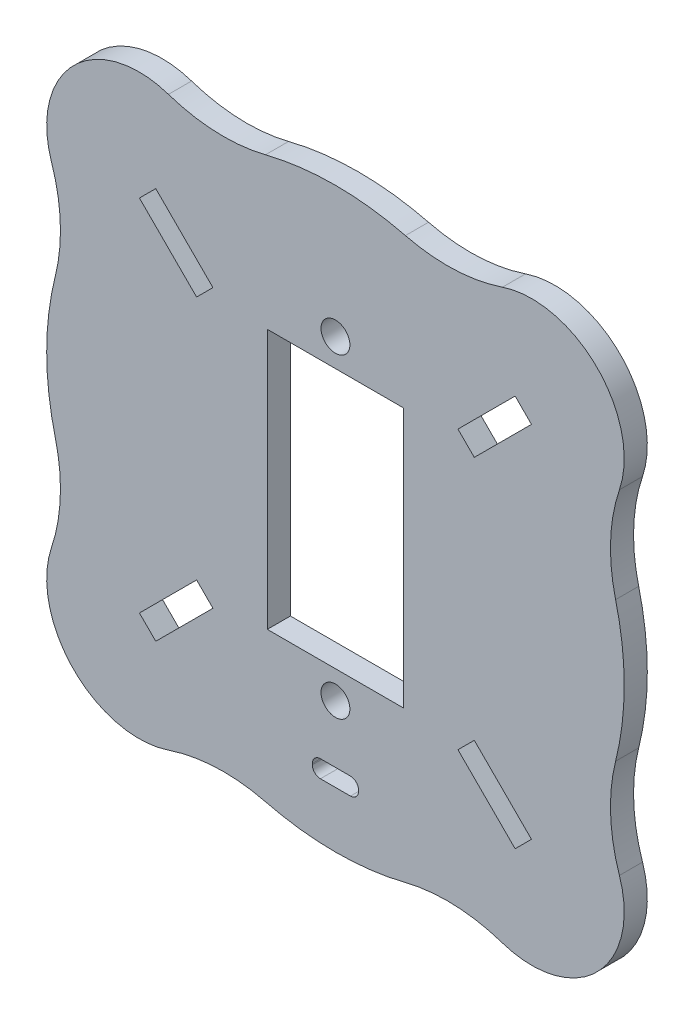
from build123d import *

# Parameters (mm, degrees)
SKETCH1_R           = 1.25
SKETCH1_W           = 11.8
SKETCH1_H           = 22.5
BOSS_EXTRUDE1_DEPTH = 2


with BuildPart() as part:
    # Sketch1 → Boss-Extrude1 (new body)
    with BuildSketch(Plane.XY):
        with BuildLine():
            ThreePointArc((6.057454149, 24.255045851), (0, 25), (-6.057454149, 24.255045851))
            ThreePointArc((-6.057454149, 24.255045851), (-10.281376502, 23.819659541), (-14.458061439, 24.585416821))
            ThreePointArc((-14.458061439, 24.585416821), (-22.656854249, 22.656854249), (-24.585416821, 14.458061439))
            ThreePointArc((-24.585416821, 14.458061439), (-23.819659541, 10.281376502), (-24.255045851, 6.057454149))
            ThreePointArc((-24.255045851, 6.057454149), (-25, 0), (-24.255045851, -6.057454149))
            ThreePointArc((-24.255045851, -6.057454149), (-23.819659541, -10.281376502), (-24.585416821, -14.458061439))
            ThreePointArc((-24.585416821, -14.458061439), (-22.656854249, -22.656854249), (-14.458061439, -24.585416821))
            ThreePointArc((-14.458061439, -24.585416821), (-10.281376502, -23.819659541), (-6.057454149, -24.255045851))
            ThreePointArc((-6.057454149, -24.255045851), (0, -25), (6.057454149, -24.255045851))
            ThreePointArc((6.057454149, -24.255045851), (10.281376502, -23.819659541), (14.458061439, -24.585416821))
            ThreePointArc((14.458061439, -24.585416821), (22.656854249, -22.656854249), (24.585416821, -14.458061439))
            ThreePointArc((24.585416821, -14.458061439), (23.819659541, -10.281376502), (24.255045851, -6.057454149))
            ThreePointArc((24.255045851, -6.057454149), (25, 0), (24.255045851, 6.057454149))
            ThreePointArc((24.255045851, 6.057454149), (23.819659541, 10.281376502), (24.585416821, 14.458061439))
            ThreePointArc((24.585416821, 14.458061439), (22.656854249, 22.656854249), (14.458061439, 24.585416821))
            ThreePointArc((14.458061439, 24.585416821), (10.281376502, 23.819659541), (6.057454149, 24.255045851))
        make_face()
        with Locations((0, 13.65)):
            Circle(SKETCH1_R, mode=Mode.SUBTRACT)
        with Locations(Location((0, -13.65, 0), (0, 0, 180))):
            Circle(SKETCH1_R, mode=Mode.SUBTRACT)
        with BuildLine():
            Line((1.3, -18.65), (-1.3, -18.65))
            ThreePointArc((-1.3, -18.65), (-1.794974747, -18.855025253), (-2, -19.35))
            Line((-2, -19.35), (-2, -19.45))
            ThreePointArc((-2, -19.45), (-1.794974747, -19.944974747), (-1.3, -20.15))
            Line((-1.3, -20.15), (1.3, -20.15))
            ThreePointArc((1.3, -20.15), (1.794974747, -19.944974747), (2, -19.45))
            Line((2, -19.45), (2, -19.35))
            ThreePointArc((2, -19.35), (1.794974747, -18.855025253), (1.3, -18.65))
        make_face(mode=Mode.SUBTRACT)
        Rectangle(SKETCH1_W, SKETCH1_H, mode=Mode.SUBTRACT)
        Polygon((-12.02081528, 10.606601718), (-10.606601718, 12.02081528), (-15.556349186, 16.970562748), (-16.970562748, 15.556349186), align=None, mode=Mode.SUBTRACT)
        Polygon((10.606601718, 12.02081528), (15.556349186, 16.970562748), (16.970562748, 15.556349186), (12.02081528, 10.606601718), align=None, mode=Mode.SUBTRACT)
        Polygon((12.02081528, -10.606601718), (10.606601718, -12.02081528), (15.556349186, -16.970562748), (16.970562748, -15.556349186), align=None, mode=Mode.SUBTRACT)
        Polygon((-16.970562748, -15.556349186), (-12.02081528, -10.606601718), (-10.606601718, -12.02081528), (-15.556349186, -16.970562748), align=None, mode=Mode.SUBTRACT)
    extrude(amount=BOSS_EXTRUDE1_DEPTH)


solid = part.part
